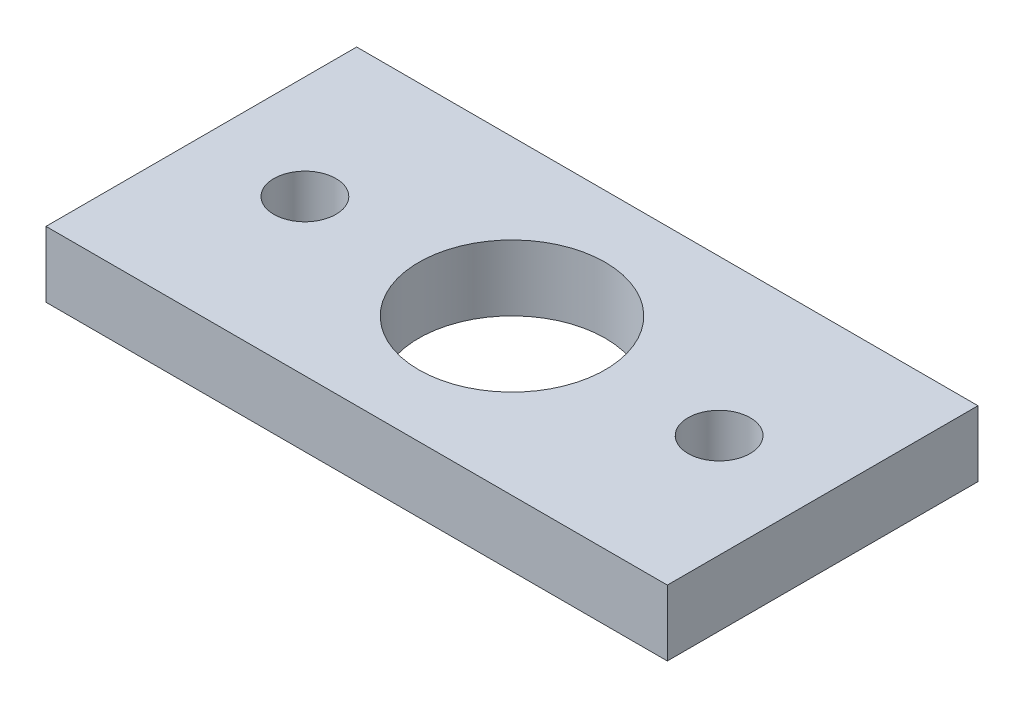
from build123d import *

# Parameters (mm, degrees)
SKETCH1_W           = 30
SKETCH1_H           = 15
SKETCH1_R           = 4.5
SKETCH1_R_2         = 1.5
BOSS_EXTRUDE2_DEPTH = 3.175


with BuildPart() as part:
    # Sketch1 → Boss-Extrude2 (new body)
    with BuildSketch(Plane(origin=(0, 0, 0), x_dir=(1, 0, 0), z_dir=(0, 1, 0))):
        with Locations((15, 7.5)):
            Rectangle(SKETCH1_W, SKETCH1_H)
        with Locations(Location((15, 7.5, 0), (0, 0, 270))):
            Circle(SKETCH1_R, mode=Mode.SUBTRACT)
        with Locations(Location((25, 7.5, 0), (0, 0, 270))):
            Circle(SKETCH1_R_2, mode=Mode.SUBTRACT)
        with Locations(Location((5, 7.5, 0), (0, 0, 270))):
            Circle(SKETCH1_R_2, mode=Mode.SUBTRACT)
    extrude(amount=BOSS_EXTRUDE2_DEPTH)


solid = part.part
